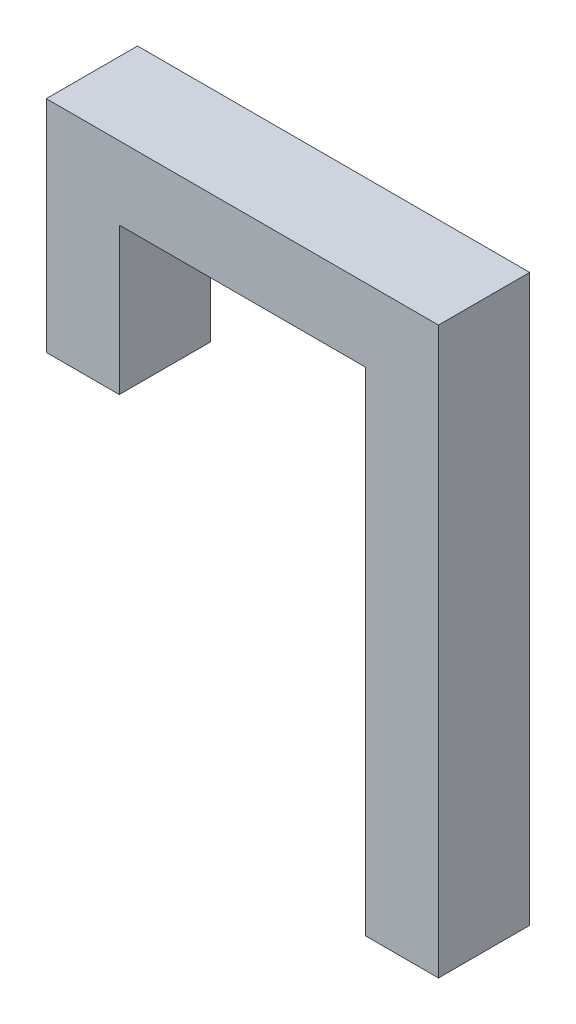
from build123d import *

# Parameters (mm, degrees)
BOSS_EXTRUDE1_DEPTH = 5


with BuildPart() as part:
    # Sketch1 → Boss-Extrude1 (new body)
    with BuildSketch(Plane.XY):
        Polygon((0, 0), (13.5, 0), (13.5, -27), (17.5, -27), (17.5, 4), (-4, 4), (-4, -8.05), (0, -8.05), align=None)
    extrude(amount=BOSS_EXTRUDE1_DEPTH)


solid = part.part
